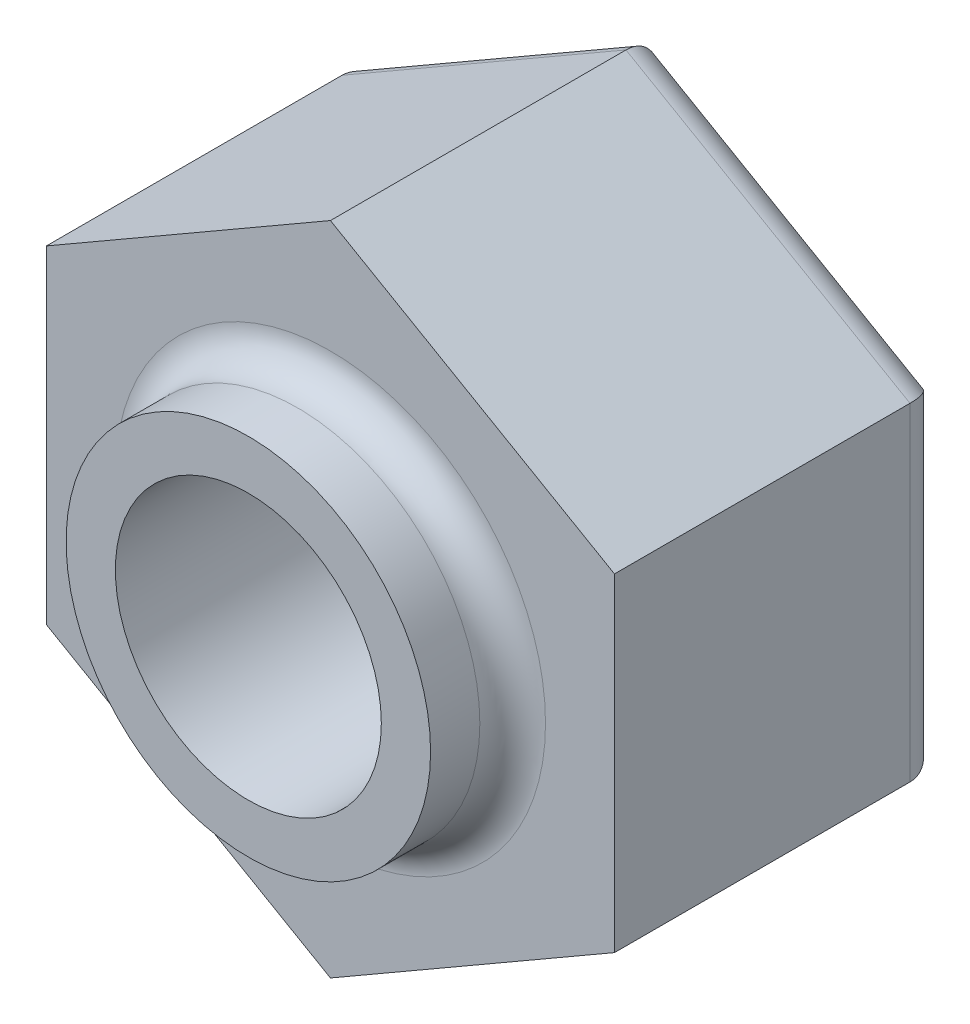
from build123d import *

# Parameters (mm, degrees)
SKETCH1_R           = 4.05
BOSS_EXTRUDE1_DEPTH = 10
SKETCH2_R           = 5.55
SKETCH2_R_2         = 4.05
BOSS_EXTRUDE2_DEPTH = 2.5
FILLET1_R           = 1


with BuildPart() as part:
    # Sketch1 → Boss-Extrude1 (new body)
    with BuildSketch(Plane.XY):
        Polygon((8.65, -4.994079828), (8.65, 4.994079828), (0, 9.988159657), (-8.65, 4.994079828), (-8.65, -4.994079828), (0, -9.988159657), align=None)
        Circle(SKETCH1_R, mode=Mode.SUBTRACT)
    extrude(amount=BOSS_EXTRUDE1_DEPTH)

    # Sketch2 → Boss-Extrude2 (add)
    with BuildSketch(Plane.XY.offset(10)):
        Circle(SKETCH2_R)
        Circle(SKETCH2_R_2, mode=Mode.SUBTRACT)
    extrude(amount=BOSS_EXTRUDE2_DEPTH)

    # Fillet1
    fillet1_edges = [part.edges().sort_by_distance(p)[0] for p in [
        (-4.05, 0, 0),
        (-5.55, 0, 10),
        (-4.325, -7.491119743, 0),
        (-8.65, 0, 0),
        (-4.325, 7.491119743, 0),
        (4.325, 7.491119743, 0),
        (8.65, 0, 0),
        (4.325, -7.491119743, 0),
    ]]
    fillet(fillet1_edges, radius=FILLET1_R)


solid = part.part
